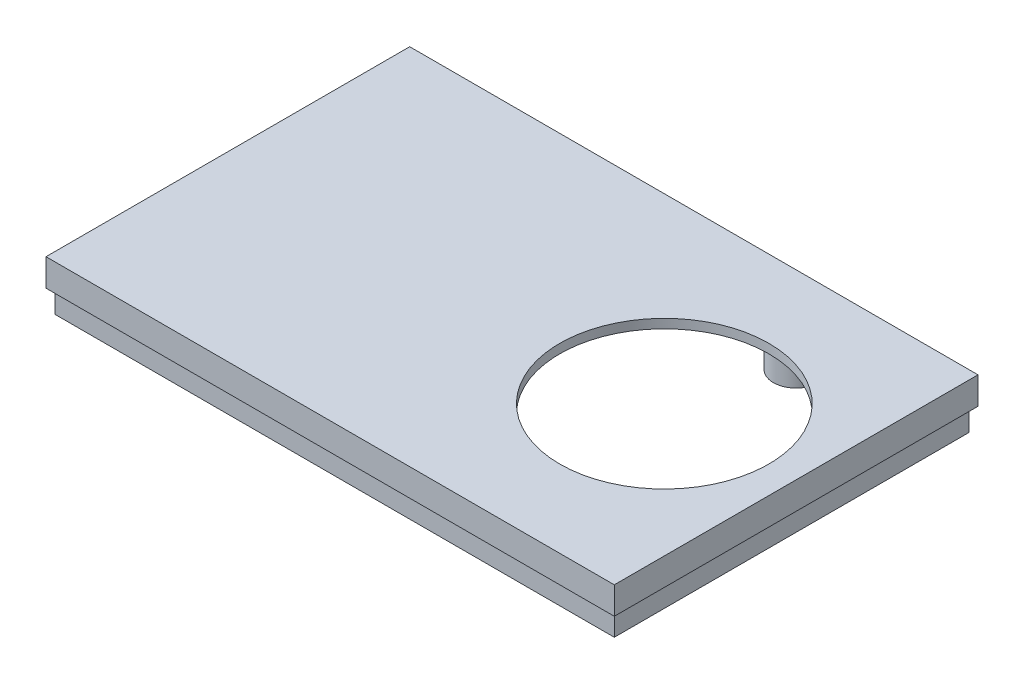
from build123d import *

# Parameters (mm, degrees)
SKETCH_1_W          = 61.5
SKETCH_1_H          = 39
EXTRUDE_1_DEPTH     = 5.5
SKETCH_2_W          = 39
SKETCH_2_H          = 3
EXTRUDE_2_DEPTH     = 0.5
SKETCH_3_W          = 62
SKETCH_3_H          = 3
EXTRUDE_3_DEPTH     = 0.5
SKETCH_5_W          = 39.5
SKETCH_5_H          = 3
EXTRUDE_4_DEPTH     = 0.5
SKETCH_6_W          = 62.5
SKETCH_6_H          = 3
EXTRUDE_5_DEPTH     = 0.5
SKETCH_7_W          = 60.5
SKETCH_7_H          = 38
CUT_EXTRUDE_1_DEPTH = 4.5
SKETCH_8_R          = 11.5
CUT_EXTRUDE_2_DEPTH = 12
SKETCH_9_R          = 2.5
EXTRUDE_7_DEPTH     = 4
SKETCH_10_R         = 1.003246397
SKETCH_10_R_2       = 1
CUT_EXTRUDE_3_DEPTH = 3


with BuildPart() as part:
    # Эскиз1 → Бобышка-Вытянуть1 (new body)
    with BuildSketch(Plane(origin=(0, 0, 0), x_dir=(1, 0, 0), z_dir=(0, 1, 0))):
        with Locations((-8.529069767, -12.848837209)):
            Rectangle(SKETCH_1_W, SKETCH_1_H)
    extrude(amount=EXTRUDE_1_DEPTH)

    # Эскиз2 → Бобышка-Вытянуть2 (add)
    with BuildSketch(Plane.ZY.offset(39.279069767)):
        with Locations((12.848837209, 4)):
            Rectangle(SKETCH_2_W, SKETCH_2_H)
    extrude(amount=EXTRUDE_2_DEPTH)

    # Эскиз3 → Бобышка-Вытянуть3 (add)
    with BuildSketch(Plane.XY.offset(32.348837209)):
        with Locations((-8.779069767, 4)):
            Rectangle(SKETCH_3_W, SKETCH_3_H)
    extrude(amount=EXTRUDE_3_DEPTH)

    # Эскиз5 → Бобышка-Вытянуть4 (add)
    with BuildSketch(Plane(origin=(22.220930233, 0, 0), x_dir=(0, 0, -1), z_dir=(1, 0, 0))):
        with Locations((-13.098837209, 4)):
            Rectangle(SKETCH_5_W, SKETCH_5_H)
    extrude(amount=EXTRUDE_4_DEPTH)

    # Эскиз6 → Бобышка-Вытянуть5 (add)
    with BuildSketch(Plane(origin=(0, 0, -6.651162791), x_dir=(-1, 0, 0), z_dir=(0, 0, -1))):
        with Locations((8.529069767, 4)):
            Rectangle(SKETCH_6_W, SKETCH_6_H)
    extrude(amount=EXTRUDE_5_DEPTH)

    # Эскиз7 → Вырез-Вытянуть1 (cut)
    with BuildSketch(Plane.XZ):
        with Locations((-8.529069767, 12.848837209)):
            Rectangle(SKETCH_7_W, SKETCH_7_H)
    extrude(amount=-CUT_EXTRUDE_1_DEPTH, mode=Mode.SUBTRACT)

    # Эскиз8 → Вырез-Вытянуть2 (cut)
    with BuildSketch(Plane(origin=(0, 5.5, 0), x_dir=(1, 0, 0), z_dir=(0, 1, 0))):
        with Locations(Location((8.220930233, -12.848837209, 0), (0, 0, 270))):
            Circle(SKETCH_8_R)
    extrude(amount=-CUT_EXTRUDE_2_DEPTH, mode=Mode.SUBTRACT)

    # Эскиз9 → Бобышка-Вытянуть7 (add)
    with BuildSketch(Plane(origin=(0, 5.5, 0), x_dir=(1, 0, 0), z_dir=(0, 1, 0))):
        with Locations(Location((8.220930233, 1.651162791, 0), (0, 0, 270))):
            Circle(SKETCH_9_R)
        with Locations(Location((8.220930233, -27.348837209, 0), (0, 0, 270))):
            Circle(SKETCH_9_R)
    extrude(amount=-EXTRUDE_7_DEPTH)

    # Эскиз10 → Вырез-Вытянуть3 (cut)
    with BuildSketch(Plane.XZ.offset(-1.5)):
        with Locations(Location((8.220930233, -1.651162791, 0), (0, 0, 270))):
            Circle(SKETCH_10_R)
        with Locations(Location((8.220930233, 27.348837209, 0), (0, 0, 270))):
            Circle(SKETCH_10_R_2)
    extrude(amount=-CUT_EXTRUDE_3_DEPTH, mode=Mode.SUBTRACT)


solid = part.part
